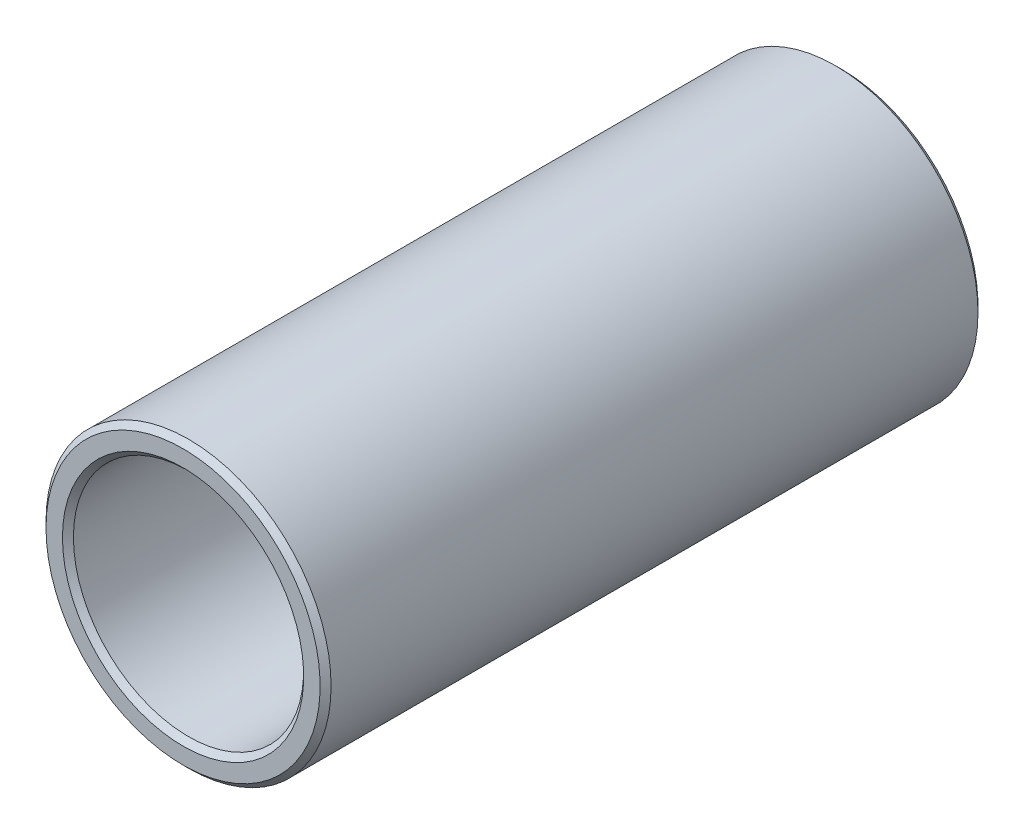
from build123d import *


with BuildPart() as part:
    # Эскиз1 → Повернуть1 (revolve)
    with BuildSketch(Plane.XZ, mode=Mode.PRIVATE) as revolve_1_sk:
        Polygon((5.053, 0.947), (6, 0), (12.5, 0), (13, 0.5), (13, 59.5), (12.5, 60), (11, 60), (10.5, 59.5), (10.5, 13), (5.053, 12.053), align=None)
    revolve(revolve_1_sk.sketch.rotate(Axis((0, 0, 60.005), (0, 0, -1)), 180), axis=Axis((0, 0, 60.005), (0, 0, -1)))


solid = part.part
